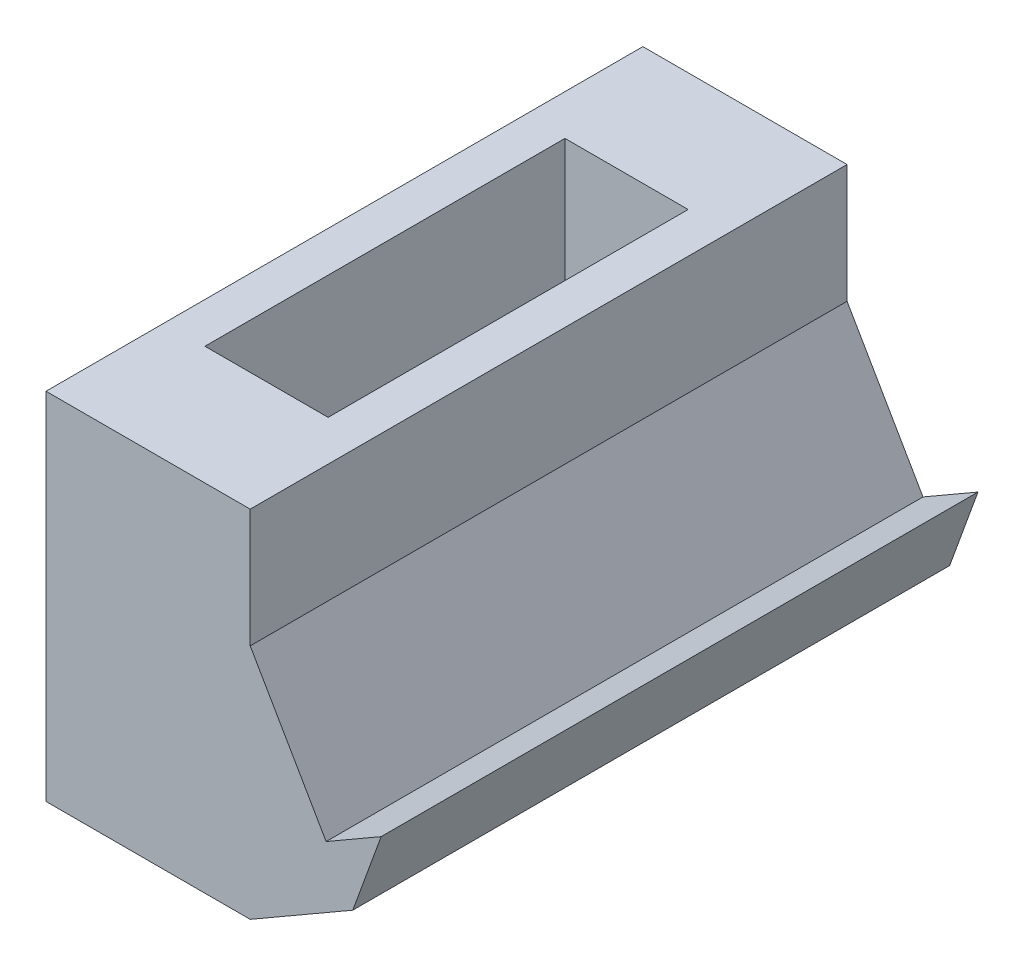
from build123d import *

# Parameters (mm, degrees)
EXTRUDE_1_DEPTH      = 5
EXTRUDE_1_DEPTH_BACK = 10
SKETCH_1_W           = 8.621052632
SKETCH_1_H           = 25.2
SKETCH_1_W_2         = 5.2
SKETCH_1_H_2         = 15.2
EXTRUDE_2_DEPTH      = 25.2


with BuildPart() as part:
    # 草图1 → 凸台-拉伸1 (new, two sides: drawn at the far end of the back side and taken through both)
    with BuildSketch(Plane(origin=(0, 0, 0), x_dir=(1, 0, 0), z_dir=(0, 1, 0)).offset(-EXTRUDE_1_DEPTH_BACK)):
        Rectangle(SKETCH_1_W, SKETCH_1_H)
        Rectangle(SKETCH_1_W_2, SKETCH_1_H_2, mode=Mode.SUBTRACT)
    extrude(amount=EXTRUDE_1_DEPTH + EXTRUDE_1_DEPTH_BACK)

    # 草图2 → 凸台-拉伸2 (add)
    with BuildSketch(Plane.XY.offset(12.6)):
        Polygon((8.640653335, -7.5), (9.837723836, -4.211075827), (7.515775018, -5.551653603), (4.310526316, 0), (4.310526316, -10), align=None)
    extrude(amount=-EXTRUDE_2_DEPTH)


solid = part.part
